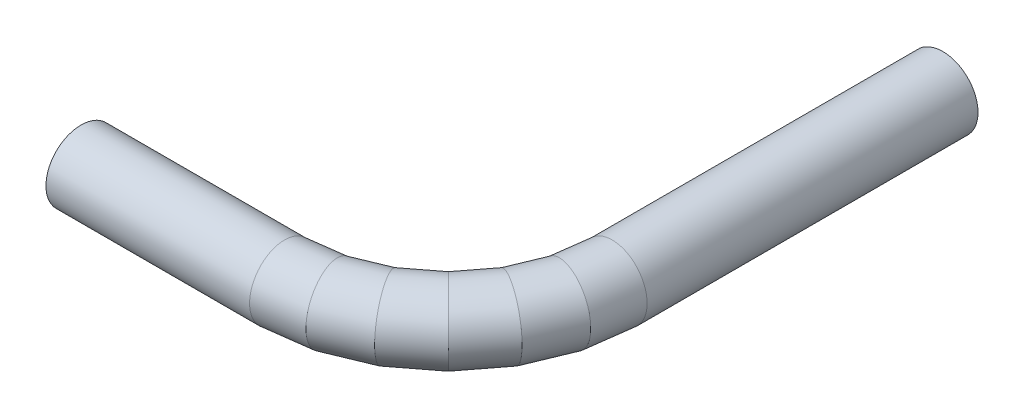
from build123d import *

# Parameters (mm, degrees)
PROFILE_R   = 3.175
PROFILE_R_2 = 2.286


with BuildPart() as part:
    # Tube: sweep along a curve in space
    with BuildLine() as tube_path:
        Line((-2944.792778381, 0, 70), (-2926.592778381, 0, 70))
        Line((-2926.592778381, 0, 70), (-2922.710492704, 0, 69.488887394))
        Line((-2922.710492704, 0, 69.488887394), (-2919.092778381, 0, 67.990381057))
        Line((-2919.092778381, 0, 67.990381057), (-2915.986176663, 0, 65.606601718))
        Line((-2915.986176663, 0, 65.606601718), (-2913.602397324, 0, 62.5))
        Line((-2913.602397324, 0, 62.5), (-2912.103890986, 0, 58.882285677))
        Line((-2912.103890986, 0, 58.882285677), (-2911.592778381, 0, 55))
        Line((-2911.592778381, 0, 55), (-2911.592778381, 0, 25.3))
    # Profile → Tube (sweep)
    with BuildSketch(Plane(origin=(-2944.792778381, 0, 0), x_dir=(0, 0, -1), z_dir=(1, 0, 0))):
        with Locations((-70, 0)):
            Circle(PROFILE_R)
        with Locations((-70, 0)):
            Circle(PROFILE_R_2, mode=Mode.SUBTRACT)
    sweep(path=tube_path.line, transition=Transition.RIGHT)


solid = part.part
